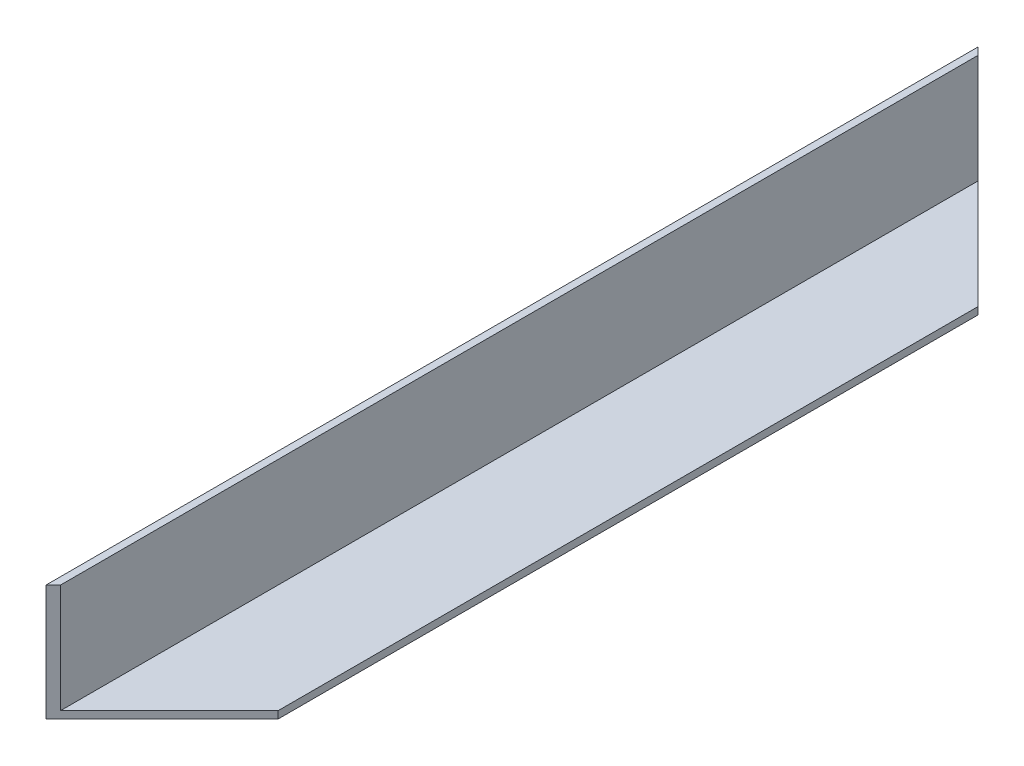
from build123d import *

# Parameters (mm, degrees)
EXTRUDE_THIN6_DEPTH = 257
CUT_EXTRUDE1_DEPTH  = 261.716320931


with BuildPart() as part:
    # Sketch2 → Extrude-Thin6 (new body)
    with BuildSketch(Plane.XY):
        Polygon((30, 0), (0, 0), (0, 30), (-2, 30), (-2, -2), (30, -2), align=None)
    extrude(amount=EXTRUDE_THIN6_DEPTH)

    # Sketch3 → Cut-Extrude1 (cut, through all)
    with BuildSketch(Plane(origin=(0, -2, 0), x_dir=(1, 0, 0), z_dir=(0, 1, 0))):
        Polygon((-2, 0), (30, -32), (30, 0), align=None)
        Polygon((30, -257), (30, -225), (-2, -257), align=None)
    extrude(amount=CUT_EXTRUDE1_DEPTH, mode=Mode.SUBTRACT)


solid = part.part
